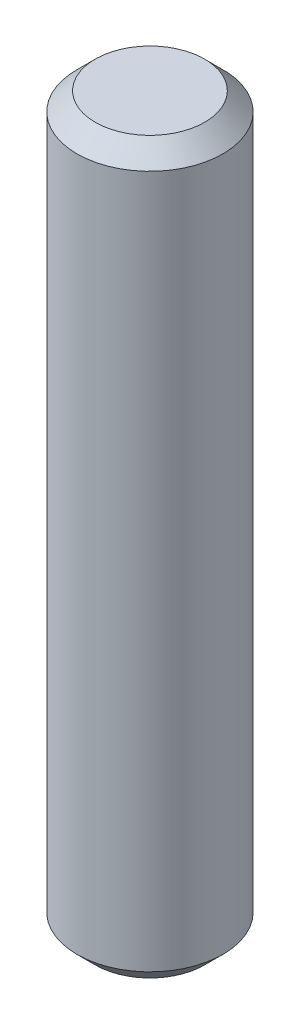
from build123d import *

# Parameters (mm, degrees)
SKETCH_1_R      = 4
EXTRUDE_1_DEPTH = 40
CHAMFER_1_SIZE  = 1


with BuildPart() as part:
    # Эскиз1 → Бобышка-Вытянуть1 (new body)
    with BuildSketch(Plane(origin=(0, 0, 0), x_dir=(1, 0, 0), z_dir=(0, 1, 0))):
        with Locations(Location((0, 0, 0), (0, 0, 270))):
            Circle(SKETCH_1_R)
    extrude(amount=EXTRUDE_1_DEPTH)

    # Фаска1
    chamfer_1_edges = [part.edges().sort_by_distance(p)[0] for p in [
        (0, 0, -4),
        (0, 40, -4),
    ]]
    chamfer(chamfer_1_edges, length=CHAMFER_1_SIZE)


solid = part.part
